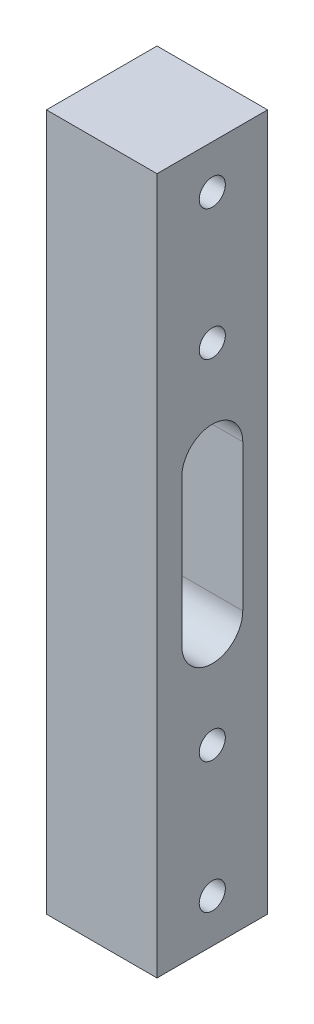
from build123d import *

# Parameters (mm, degrees)
SKETCH1_W           = 12.7
SKETCH1_H           = 80
SKETCH1_R           = 1.5
BOSS_EXTRUDE1_DEPTH = 12.7


with BuildPart() as part:
    # Sketch1 → Boss-Extrude1 (new body)
    with BuildSketch(Plane(origin=(572.952355873, -103.733491168, -119.473981867), x_dir=(0, 0, 1), z_dir=(1, 0, 0))):
        with Locations((-165.577945174, 149.370143232)):
            Rectangle(SKETCH1_W, SKETCH1_H)
        with Locations(Location((-165.577945174, 169.370143232, 0), (0, 0, 270))):
            Circle(SKETCH1_R, mode=Mode.SUBTRACT)
        with Locations(Location((-165.577945174, 184.370143232, 0), (0, 0, 270))):
            Circle(SKETCH1_R, mode=Mode.SUBTRACT)
        with Locations(Location((-165.577945174, 114.370143232, 0), (0, 0, 270))):
            Circle(SKETCH1_R, mode=Mode.SUBTRACT)
        with Locations(Location((-165.577945174, 129.370143232, 0), (0, 0, 270))):
            Circle(SKETCH1_R, mode=Mode.SUBTRACT)
        with BuildLine():
            Line((-162.077945174, 157.77541555), (-162.077945174, 140.964870914))
            ThreePointArc((-162.077945174, 140.964870914), (-165.577945174, 137.464870914), (-169.077945174, 140.964870914))
            Line((-169.077945174, 140.964870914), (-169.077945174, 157.77541555))
            ThreePointArc((-169.077945174, 157.77541555), (-165.577945174, 161.27541555), (-162.077945174, 157.77541555))
        make_face(mode=Mode.SUBTRACT)
    extrude(amount=BOSS_EXTRUDE1_DEPTH)


solid = part.part
